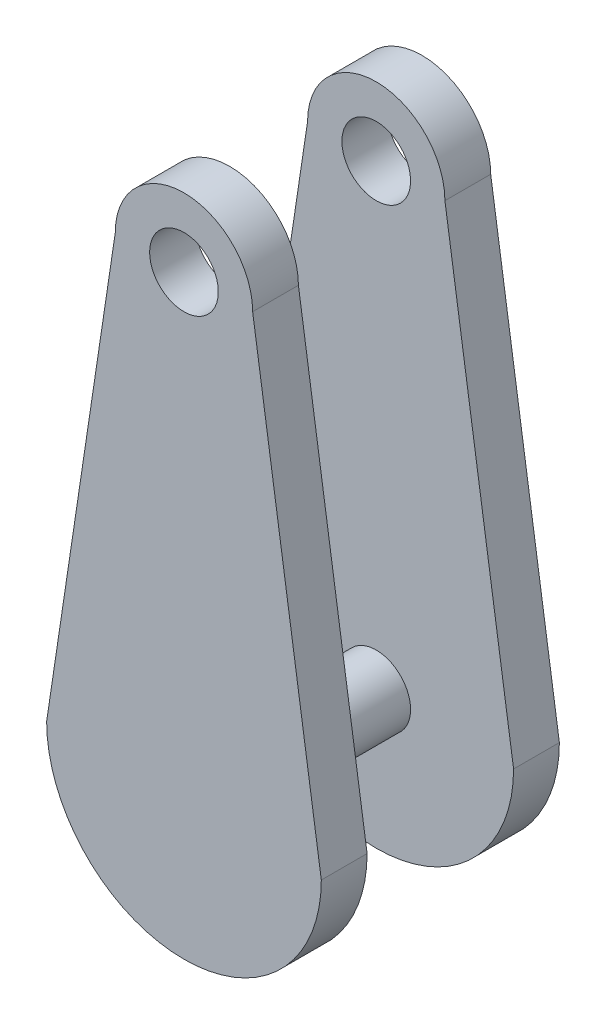
from build123d import *

# Parameters (mm, degrees)
SKETCH1_R           = 7.5
SKETCH1_R_2         = 5
BOSS_EXTRUDE4_DEPTH = 10
BOSS_EXTRUDE5_START = -52
SKETCH6_R           = 7.5
BOSS_EXTRUDE5_DEPTH = 52
BOSS_EXTRUDE7_START = 2
SKETCH8_R           = 10
SKETCH8_R_2         = 7.5
BOSS_EXTRUDE7_DEPTH = 2
SKETCH10_R          = 7.5
CUT_EXTRUDE2_DEPTH  = 130.726635661


with BuildPart() as part:
    # Sketch1 → Boss-Extrude4 (new body)
    with BuildSketch(Plane.XY):
        with BuildLine():
            ThreePointArc((15, 100), (0, 115), (-15, 100))
            Line((-15, 100), (-28.679706601, 8.80195599))
            Line((-28.679706601, 8.80195599), (-30, 0))
            ThreePointArc((-30, 0), (0, -30), (30, 0))
            Line((30, 0), (28.679706601, 8.80195599))
            Line((28.679706601, 8.80195599), (15, 100))
        make_face()
        Circle(SKETCH1_R, mode=Mode.SUBTRACT)
        with Locations((0, 100)):
            Circle(SKETCH1_R_2, mode=Mode.SUBTRACT)
    boss_extrude4 = extrude(amount=BOSS_EXTRUDE4_DEPTH)

    # Sketch6 → Boss-Extrude5 (add)
    with BuildSketch(Plane.XY.offset(10).offset(BOSS_EXTRUDE5_START)):
        Circle(SKETCH6_R)
    extrude(amount=BOSS_EXTRUDE5_DEPTH)

    # Mirror1: Boss-Extrude4 across plane
    add(boss_extrude4.mirror(Plane.XY.offset(-16)))

    # Sketch8 → Boss-Extrude7 (add)
    with BuildSketch(Plane(origin=(0, 0, 0), x_dir=(-1, 0, 0), z_dir=(0, 0, -1)).offset(BOSS_EXTRUDE7_START)):
        with Locations(Location((0, 0, 0), (0, 0, 180))):
            Circle(SKETCH8_R)
        with Locations(Location((0, 0, 0), (0, 0, 180))):
            Circle(SKETCH8_R_2, mode=Mode.SUBTRACT)
    extrude(amount=-BOSS_EXTRUDE7_DEPTH)

    # Sketch10 → Cut-Extrude2 (cut, through all)
    with BuildSketch(Plane(origin=(0, 0, -42), x_dir=(-1, 0, 0), z_dir=(0, 0, -1))):
        with Locations((0, 100)):
            Circle(SKETCH10_R)
    extrude(amount=-CUT_EXTRUDE2_DEPTH, mode=Mode.SUBTRACT)


solid = part.part
